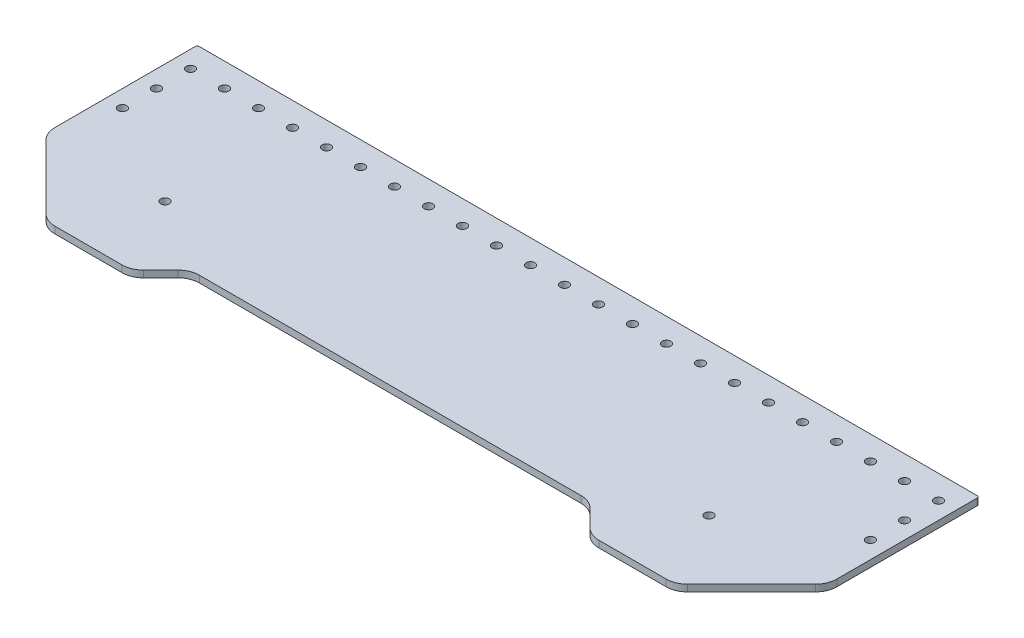
from build123d import *

# Parameters (mm, degrees)
SKETCH3_R           = 2.05
BOSS_EXTRUDE2_DEPTH = 3.175
FILLET1_R           = 10
FILLET2_R           = 1
SKETCH6_R           = 2.05
CUT_EXTRUDE3_DEPTH  = 3.18


with BuildPart() as part:
    # Sketch3 → Boss-Extrude2 (new body)
    with BuildSketch(Plane(origin=(0, 0, 0), x_dir=(1, 0, 0), z_dir=(0, 1, 0))):
        Polygon((-184, -11.5875), (-148, -47.5875), (-108, -47.5875), (-94, -33.5875), (94, -33.5875), (108, -47.5875), (148, -47.5875), (184, -11.5875), (184, 59.5875), (-184, 59.5875), align=None)
        with Locations(Location((-128, -11.5875, 0), (0, 0, 270))):
            Circle(SKETCH3_R, mode=Mode.SUBTRACT)
        with Locations(Location((128, -11.5875, 0), (0, 0, 90))):
            Circle(SKETCH3_R, mode=Mode.SUBTRACT)
    extrude(amount=BOSS_EXTRUDE2_DEPTH)

    # Fillet1
    fillet1_edges = [part.edges().sort_by_distance(p)[0] for p in [
        (184, 1.5875, 11.5875),
        (148, 1.5875, 47.5875),
        (108, 1.5875, 47.5875),
        (94, 1.5875, 33.5875),
        (-94, 1.5875, 33.5875),
        (-108, 1.5875, 47.5875),
        (-148, 1.5875, 47.5875),
        (-184, 1.5875, 11.5875),
    ]]
    fillet(fillet1_edges, radius=FILLET1_R)

    # Fillet2
    fillet2_edges = [part.edges().sort_by_distance(p)[0] for p in [
        (184, 1.5875, -59.5875),
        (-184, 1.5875, -59.5875),
    ]]
    fillet(fillet2_edges, radius=FILLET2_R)

    # Sketch6 → Cut-Extrude3 (cut)
    with BuildSketch(Plane(origin=(0, 3.175, 0), x_dir=(1, 0, 0), z_dir=(0, 1, 0))):
        with Locations(Location((-176, 48.4125, 0), (0, 0, 270))):
            Circle(SKETCH6_R)
        with Locations(Location((-160, 48.4125, 0), (0, 0, 270))):
            Circle(SKETCH6_R)
        with Locations(Location((-144, 48.4125, 0), (0, 0, 270))):
            Circle(SKETCH6_R)
        with Locations(Location((-128, 48.4125, 0), (0, 0, 270))):
            Circle(SKETCH6_R)
        with Locations(Location((-112, 48.4125, 0), (0, 0, 270))):
            Circle(SKETCH6_R)
        with Locations(Location((-96, 48.4125, 0), (0, 0, 270))):
            Circle(SKETCH6_R)
        with Locations(Location((-80, 48.4125, 0), (0, 0, 270))):
            Circle(SKETCH6_R)
        with Locations(Location((-64, 48.4125, 0), (0, 0, 270))):
            Circle(SKETCH6_R)
        with Locations(Location((-48, 48.4125, 0), (0, 0, 270))):
            Circle(SKETCH6_R)
        with Locations(Location((-32, 48.4125, 0), (0, 0, 270))):
            Circle(SKETCH6_R)
        with Locations(Location((-16, 48.4125, 0), (0, 0, 270))):
            Circle(SKETCH6_R)
        with Locations(Location((0, 48.4125, 0), (0, 0, 270))):
            Circle(SKETCH6_R)
        with Locations(Location((16, 48.4125, 0), (0, 0, 270))):
            Circle(SKETCH6_R)
        with Locations(Location((32, 48.4125, 0), (0, 0, 270))):
            Circle(SKETCH6_R)
        with Locations(Location((48, 48.4125, 0), (0, 0, 270))):
            Circle(SKETCH6_R)
        with Locations(Location((64, 48.4125, 0), (0, 0, 270))):
            Circle(SKETCH6_R)
        with Locations(Location((80, 48.4125, 0), (0, 0, 270))):
            Circle(SKETCH6_R)
        with Locations(Location((96, 48.4125, 0), (0, 0, 270))):
            Circle(SKETCH6_R)
        with Locations(Location((112, 48.4125, 0), (0, 0, 270))):
            Circle(SKETCH6_R)
        with Locations(Location((128, 48.4125, 0), (0, 0, 270))):
            Circle(SKETCH6_R)
        with Locations(Location((144, 48.4125, 0), (0, 0, 270))):
            Circle(SKETCH6_R)
        with Locations(Location((160, 48.4125, 0), (0, 0, 270))):
            Circle(SKETCH6_R)
        with Locations(Location((176, 48.4125, 0), (0, 0, 270))):
            Circle(SKETCH6_R)
        with Locations(Location((175.986011582, 32.412506115, 0), (0, 0, 270))):
            Circle(SKETCH6_R)
        with Locations(Location((175.972023163, 16.41251223, 0), (0, 0, 270))):
            Circle(SKETCH6_R)
        with Locations(Location((-176.013988418, 32.412506115, 0), (0, 0, 270))):
            Circle(SKETCH6_R)
        with Locations(Location((-176.027976837, 16.41251223, 0), (0, 0, 270))):
            Circle(SKETCH6_R)
    extrude(amount=-CUT_EXTRUDE3_DEPTH, mode=Mode.SUBTRACT)


solid = part.part
